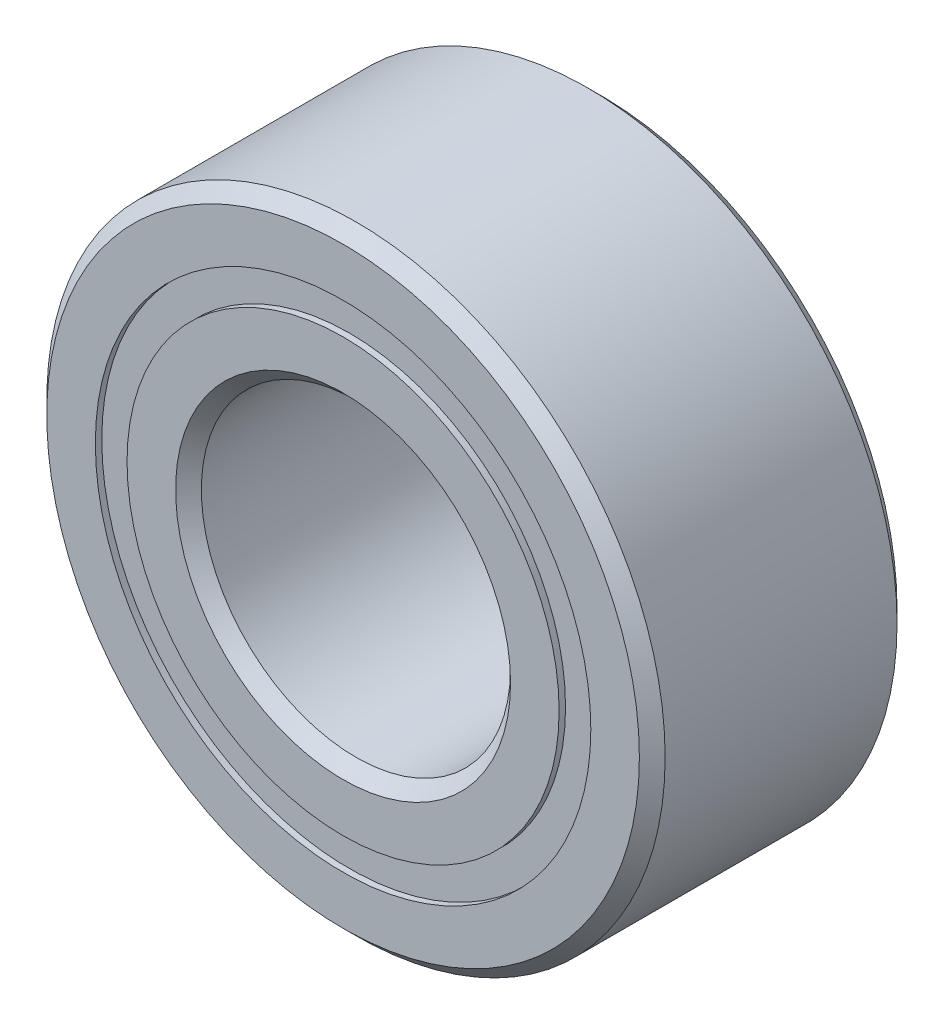
from build123d import *

# Parameters (mm, degrees)
CIRPATTERN1_COUNT = 12
SKETCH5_W         = 0.611036112
SKETCH5_H         = 0.307692308


with BuildPart() as part:
    # Sketch1 → Revolve1 (revolve)
    with BuildSketch(Plane(origin=(0, 0, 0), x_dir=(0, 0, -1), z_dir=(1, 0, 0))):
        with BuildLine():
            Line((1.125, 3), (-1.125, 3))
            Line((-1.125, 3), (-1.25, 2.875))
            Line((-1.25, 2.875), (-1.25, 2.403846154))
            Line((-1.25, 2.403846154), (-0.555555556, 2.403846154))
            ThreePointArc((-0.555555556, 2.403846154), (0, 2.826463888), (0.555555556, 2.403846154))
            Line((0.555555556, 2.403846154), (1.25, 2.403846154))
            Line((1.25, 2.403846154), (1.25, 2.875))
            Line((1.25, 2.875), (1.125, 3))
        make_face()
    revolve(axis=Axis((0, 0, 1.25), (0, 0, -1)))


with BuildPart() as body_2:
    # Sketch3 → Revolve3 (revolve)
    with BuildSketch(Plane(origin=(0, 0, 0), x_dir=(0, 0, -1), z_dir=(1, 0, 0))):
        with BuildLine():
            Line((-1.25, 2.096153846), (-0.555555556, 2.096153846))
            ThreePointArc((-0.555555556, 2.096153846), (0, 1.673536112), (0.555555556, 2.096153846))
            Line((0.555555556, 2.096153846), (1.25, 2.096153846))
            Line((1.25, 2.096153846), (1.25, 1.625))
            Line((1.25, 1.625), (1.125, 1.5))
            Line((1.125, 1.5), (-1.125, 1.5))
            Line((-1.125, 1.5), (-1.25, 1.625))
            Line((-1.25, 1.625), (-1.25, 2.096153846))
        make_face()
    revolve(axis=Axis((0, 0, 1.25), (0, 0, -1)))


with BuildPart() as body_3:
    # Sketch4 → Revolve4 (revolve)
    with BuildSketch(Plane(origin=(0, 0, 0), x_dir=(0, 0, -1), z_dir=(1, 0, 0))):
        with BuildLine():
            Line((-0.576463888, 2.25), (0.576463888, 2.25))
            ThreePointArc((0.576463888, 2.25), (0, 2.826463888), (-0.576463888, 2.25))
        make_face()
    revolve(axis=Axis((0, 2.25, 0.576463888), (0, 0, -1)))


with BuildPart() as cirpattern1_1:
    # CirPattern1: pattern copy
    add(body_3.part.rotate(Axis((0, 0, -1.25), (0, 0, 1)), 1 * 360 / CIRPATTERN1_COUNT))


with BuildPart() as cirpattern1_2:
    # CirPattern1: pattern copy
    add(body_3.part.rotate(Axis((0, 0, -1.25), (0, 0, 1)), 2 * 360 / CIRPATTERN1_COUNT))


with BuildPart() as cirpattern1_3:
    # CirPattern1: pattern copy
    add(body_3.part.rotate(Axis((0, 0, -1.25), (0, 0, 1)), 3 * 360 / CIRPATTERN1_COUNT))


with BuildPart() as cirpattern1_4:
    # CirPattern1: pattern copy
    add(body_3.part.rotate(Axis((0, 0, -1.25), (0, 0, 1)), 4 * 360 / CIRPATTERN1_COUNT))


with BuildPart() as cirpattern1_5:
    # CirPattern1: pattern copy
    add(body_3.part.rotate(Axis((0, 0, -1.25), (0, 0, 1)), 5 * 360 / CIRPATTERN1_COUNT))


with BuildPart() as cirpattern1_6:
    # CirPattern1: pattern copy
    add(body_3.part.rotate(Axis((0, 0, -1.25), (0, 0, 1)), 6 * 360 / CIRPATTERN1_COUNT))


with BuildPart() as cirpattern1_7:
    # CirPattern1: pattern copy
    add(body_3.part.rotate(Axis((0, 0, -1.25), (0, 0, 1)), 7 * 360 / CIRPATTERN1_COUNT))


with BuildPart() as cirpattern1_8:
    # CirPattern1: pattern copy
    add(body_3.part.rotate(Axis((0, 0, -1.25), (0, 0, 1)), 8 * 360 / CIRPATTERN1_COUNT))


with BuildPart() as cirpattern1_9:
    # CirPattern1: pattern copy
    add(body_3.part.rotate(Axis((0, 0, -1.25), (0, 0, 1)), 9 * 360 / CIRPATTERN1_COUNT))


with BuildPart() as cirpattern1_10:
    # CirPattern1: pattern copy
    add(body_3.part.rotate(Axis((0, 0, -1.25), (0, 0, 1)), 10 * 360 / CIRPATTERN1_COUNT))


with BuildPart() as cirpattern1_11:
    # CirPattern1: pattern copy
    add(body_3.part.rotate(Axis((0, 0, -1.25), (0, 0, 1)), 11 * 360 / CIRPATTERN1_COUNT))


with BuildPart() as body_15:
    # Sketch5 → Revolve5 (revolve)
    with BuildSketch(Plane(origin=(0, 0, 0), x_dir=(0, 0, -1), z_dir=(1, 0, 0))):
        with Locations((-0.881981944, 2.25)):
            Rectangle(SKETCH5_W, SKETCH5_H)
        with Locations((0.881981944, 2.25)):
            Rectangle(SKETCH5_W, SKETCH5_H)
    revolve(axis=Axis((0, 0, 1.25), (0, 0, -1)))


solid = Compound([part.part, body_2.part, body_3.part, cirpattern1_1.part, cirpattern1_2.part, cirpattern1_3.part, cirpattern1_4.part, cirpattern1_5.part, cirpattern1_6.part, cirpattern1_7.part, cirpattern1_8.part, cirpattern1_9.part, cirpattern1_10.part, cirpattern1_11.part, body_15.part])
